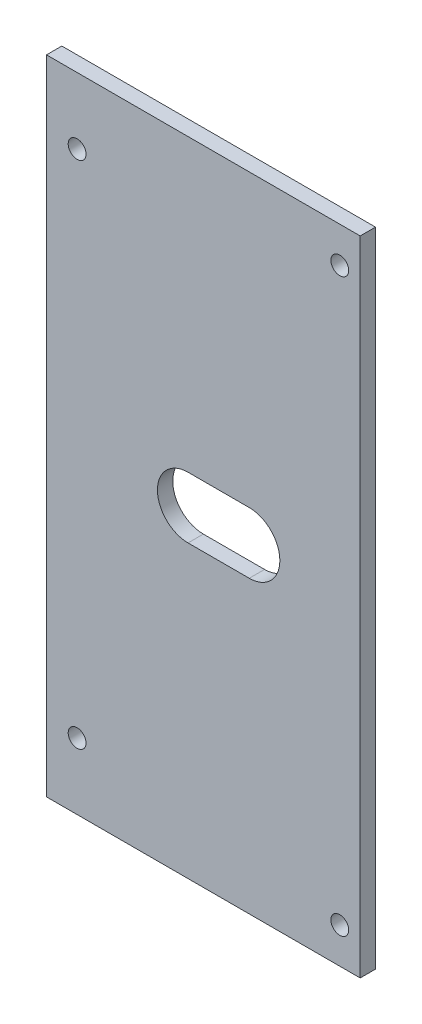
from build123d import *

# Parameters (mm, degrees)
SKETCH1_W           = 61.5
SKETCH1_H           = 126
SKETCH1_R           = 1.75
BOSS_EXTRUDE1_DEPTH = 3
CUT_EXTRUDE1_REACH  = 90.092


with BuildPart() as part:
    # Sketch1 → Boss-Extrude1 (new body)
    with BuildSketch(Plane.XY):
        with Locations((-30.75, 0)):
            Rectangle(SKETCH1_W, SKETCH1_H)
        with Locations((-4, 56)):
            Circle(SKETCH1_R, mode=Mode.SUBTRACT)
        with Locations((-55.5, 50)):
            Circle(SKETCH1_R, mode=Mode.SUBTRACT)
        with Locations(Location((-4, -56, 0), (0, 0, 180))):
            Circle(SKETCH1_R, mode=Mode.SUBTRACT)
        with Locations(Location((-55.5, -50, 0), (0, 0, 180))):
            Circle(SKETCH1_R, mode=Mode.SUBTRACT)
    extrude(amount=BOSS_EXTRUDE1_DEPTH)

    # Sketch2 → Cut-Extrude1 (cut, up to next)
    with BuildSketch(Plane.XY.offset(3), mode=Mode.PRIVATE) as cut_extrude1_sk1:
        with BuildLine():
            Line((-33.75, 6), (-21.75, 6))
            ThreePointArc((-21.75, 6), (-15.75, 0), (-21.75, -6))
            Line((-21.75, -6), (-33.75, -6))
            ThreePointArc((-33.75, -6), (-39.75, 0), (-33.75, 6))
        make_face()
    cut_extrude1_tool1 = extrude(cut_extrude1_sk1.sketch, amount=-CUT_EXTRUDE1_REACH, mode=Mode.PRIVATE) & part.part
    add(cut_extrude1_tool1.solids().sort_by_distance((-27.75, 0, 3))[0], mode=Mode.SUBTRACT)


solid = part.part
